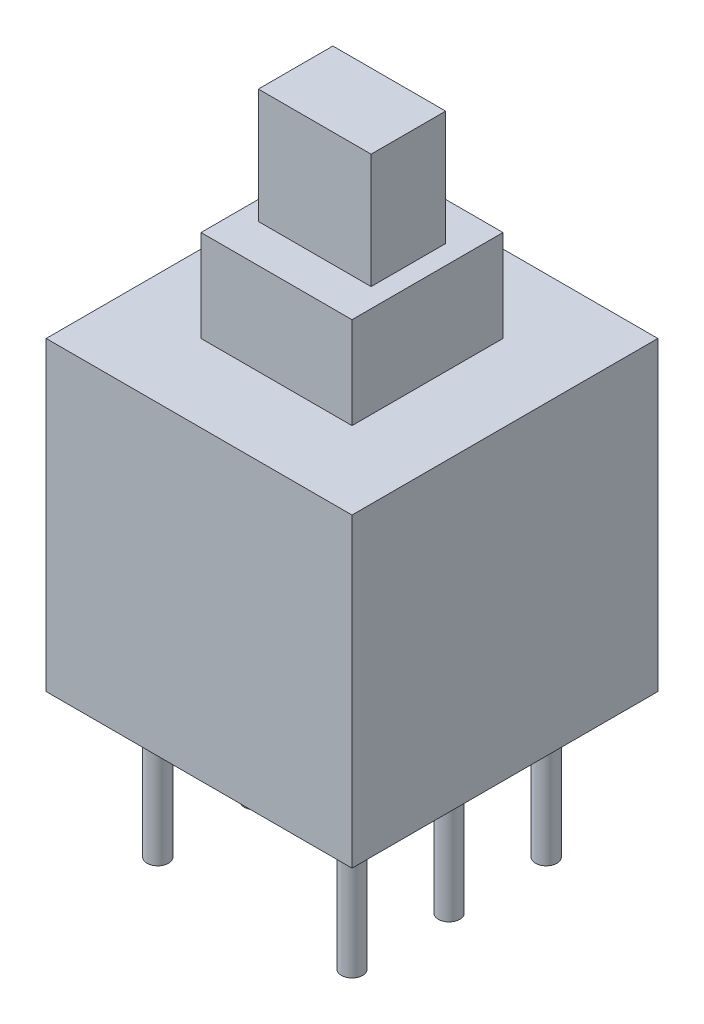
from build123d import *

# Parameters (mm, degrees)
SKETCH1_W           = 8
SKETCH1_H           = 8
BOSS_EXTRUDE1_DEPTH = 8
SKETCH2_W           = 3.95
SKETCH2_H           = 3.95
BOSS_EXTRUDE2_DEPTH = 2.4
SKETCH3_W           = 2.95
SKETCH3_H           = 1.95
BOSS_EXTRUDE3_DEPTH = 3
SKETCH4_R           = 0.28
BOSS_EXTRUDE4_DEPTH = 3.75


with BuildPart() as part:
    # Sketch1 → Boss-Extrude1 (new body)
    with BuildSketch(Plane(origin=(0, 0, 0), x_dir=(1, 0, 0), z_dir=(0, 1, 0))):
        Rectangle(SKETCH1_W, SKETCH1_H)
    extrude(amount=BOSS_EXTRUDE1_DEPTH)

    # Sketch2 → Boss-Extrude2 (add)
    with BuildSketch(Plane(origin=(0, 8, 0), x_dir=(1, 0, 0), z_dir=(0, 1, 0))):
        Rectangle(SKETCH2_W, SKETCH2_H)
    extrude(amount=BOSS_EXTRUDE2_DEPTH)

    # Sketch3 → Boss-Extrude3 (add)
    with BuildSketch(Plane(origin=(0, 10.4, 0), x_dir=(1, 0, 0), z_dir=(0, 1, 0))):
        Rectangle(SKETCH3_W, SKETCH3_H)
    extrude(amount=BOSS_EXTRUDE3_DEPTH)

    # Sketch4 → Boss-Extrude4 (add)
    with BuildSketch(Plane.XZ):
        with Locations(Location((2.54, 2.54, 0), (0, 0, 270))):
            Circle(SKETCH4_R)
        with Locations(Location((2.54, 0, 0), (0, 0, 270))):
            Circle(SKETCH4_R)
        with Locations(Location((2.54, -2.54, 0), (0, 0, 270))):
            Circle(SKETCH4_R)
        with Locations(Location((-2.54, -2.54, 0), (0, 0, 270))):
            Circle(SKETCH4_R)
        with Locations(Location((-2.54, 0, 0), (0, 0, 270))):
            Circle(SKETCH4_R)
        with Locations(Location((-2.54, 2.54, 0), (0, 0, 270))):
            Circle(SKETCH4_R)
    extrude(amount=BOSS_EXTRUDE4_DEPTH)


solid = part.part
